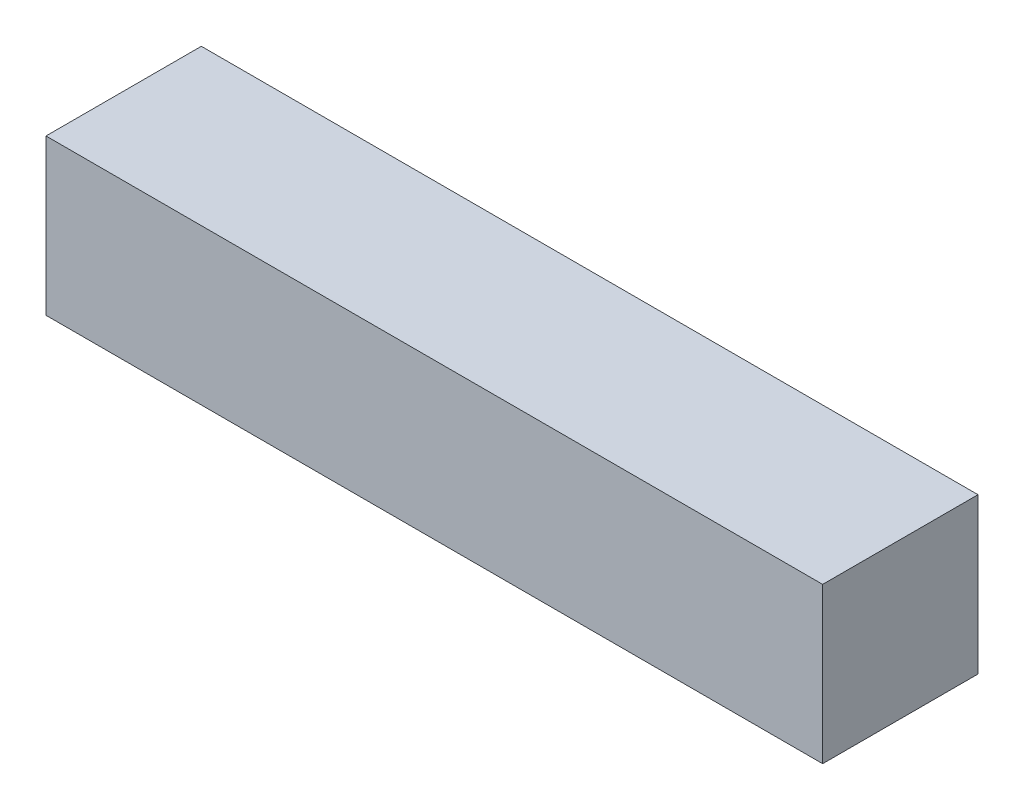
from build123d import *

# Parameters (mm, degrees)
SKETCH1_W           = 2
SKETCH1_H           = 2
BOSS_EXTRUDE1_DEPTH = 10


with BuildPart() as part:
    # Sketch1 → Boss-Extrude1 (new body)
    with BuildSketch(Plane(origin=(0, 0, 0), x_dir=(0, 0, -1), z_dir=(1, 0, 0))):
        with Locations((1, 1)):
            Rectangle(SKETCH1_W, SKETCH1_H)
    extrude(amount=BOSS_EXTRUDE1_DEPTH)


solid = part.part
